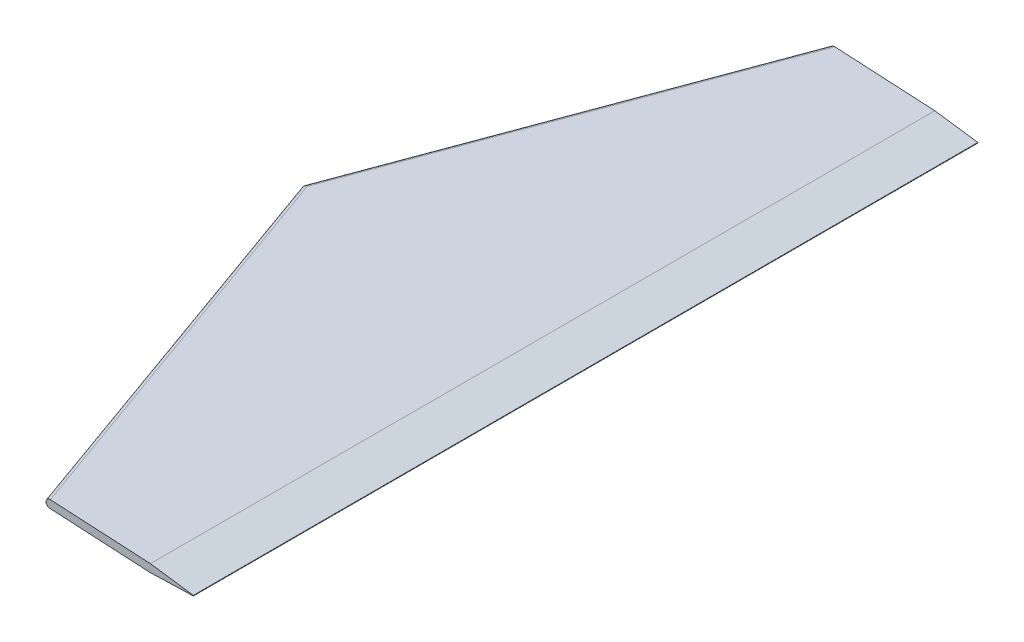
from build123d import *

# Parameters (mm, degrees)
BOSS_EXTRUDE1_DEPTH = 275.6
CUT_EXTRUDE1_DEPTH  = 342.565498998
CUT_EXTRUDE2_DEPTH  = 342.565498998
CUT_EXTRUDE3_DEPTH  = 587.943701099
CUT_EXTRUDE4_DEPTH  = 587.892777338
FILLET1_R           = 2.75
FILLET2_R           = 0.2


with BuildPart() as part:
    # Sketch1 → Boss-Extrude1 (new, symmetric)
    with BuildSketch(Plane.XY):
        Polygon((0, 0), (201.107183261, -10.856373276), (201.404089876, -5.356373276), (0.296906615, 5.5), align=None)
    extrude(amount=BOSS_EXTRUDE1_DEPTH, both=True)

    # Sketch2 → Cut-Extrude1 (cut, through all)
    with BuildSketch(Plane(origin=(0.296906615, 5.5, 0), x_dir=(0.9985460936510022, -0.053904534636001866, 0), z_dir=(0.053904534636001866, 0.9985460936510022, 0))):
        Polygon((0, 0), (95.4, 275.6), (0, 275.6), align=None)
    extrude(amount=-CUT_EXTRUDE1_DEPTH, mode=Mode.SUBTRACT)

    # Sketch3 → Cut-Extrude2 (cut, through all)
    with BuildSketch(Plane(origin=(0.296906615, 5.5, 0), x_dir=(0.9985460936510022, -0.053904534636001866, 0), z_dir=(0.053904534636001866, 0.9985460936510022, 0))):
        Polygon((0, 0), (95.4, -275.6), (0, -275.6), align=None)
    extrude(amount=-CUT_EXTRUDE2_DEPTH, mode=Mode.SUBTRACT)

    # Sketch4 → Cut-Extrude3 (cut, through all)
    with BuildSketch(Plane.XY.offset(275.6)):
        Polygon((168.751632614, -3.593694993), (201.255636569, -8.106373276), (201.404089876, -5.356373276), align=None)
    extrude(amount=-CUT_EXTRUDE3_DEPTH, mode=Mode.SUBTRACT)

    # Sketch5 → Cut-Extrude4 (cut, through all)
    with BuildSketch(Plane.XY.offset(275.6)):
        Polygon((201.255636569, -8.106373276), (168.454725999, -9.093694993), (201.107183261, -10.856373276), align=None)
    extrude(amount=-CUT_EXTRUDE4_DEPTH, mode=Mode.SUBTRACT)

    # Fillet1
    fillet1_edges = [part.edges().sort_by_distance(p)[0] for p in [
        (47.630648667, -2.571246302, -137.8),
        (47.927555282, 2.928753698, -137.8),
        (47.630648667, -2.571246302, 137.8),
        (47.927555282, 2.928753698, 137.8),
    ]]
    fillet(fillet1_edges, radius=FILLET1_R)

    # Fillet2
    fillet2_edges = [part.edges().sort_by_distance(p)[0] for p in [
        (201.255636569, -8.106373276, 0),
    ]]
    fillet(fillet2_edges, radius=FILLET2_R)


solid = part.part
